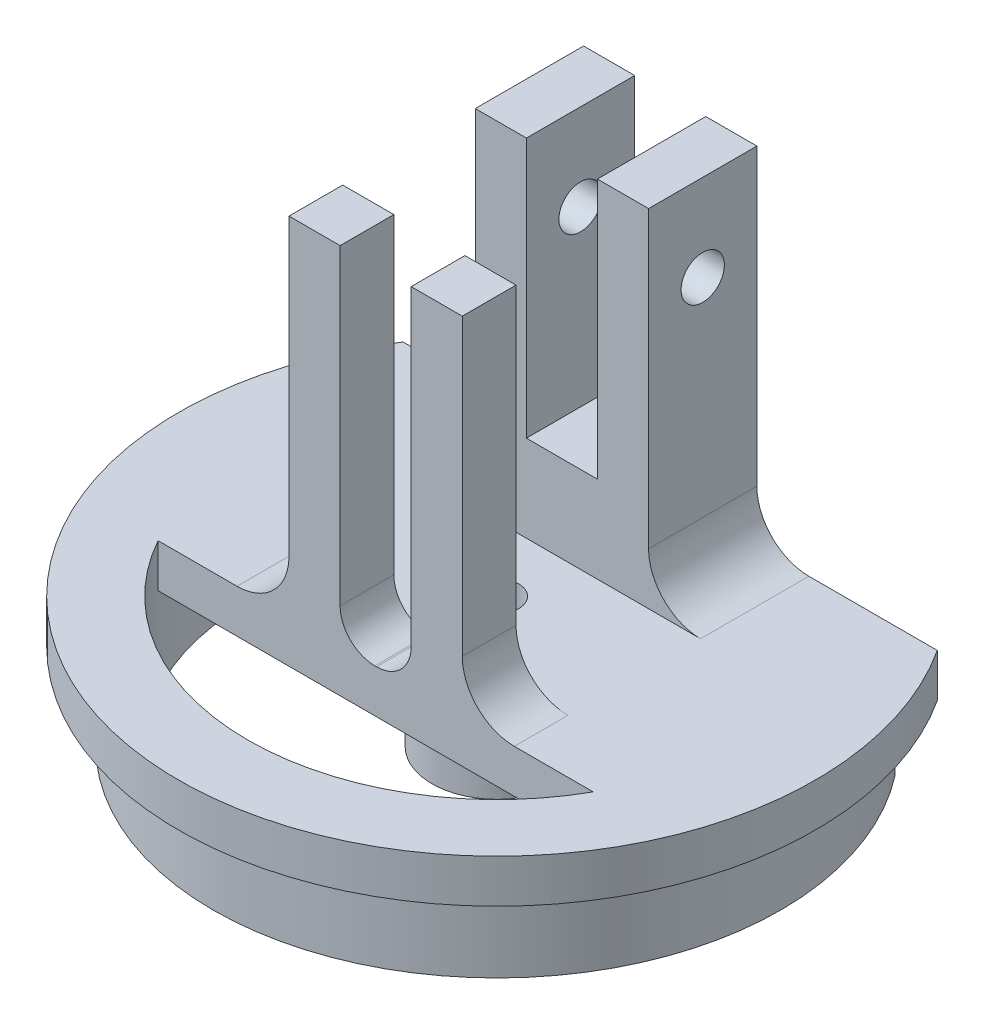
from build123d import *

# Parameters (mm, degrees)
CYLINDER_DEPTH                  = 5
CYLINDER_DEPTH_BACK             = 10
SKETCH_1_R                      = 7.5
SKETCH_1_R_2                    = 2.5
SKETCH_2_R                      = 36.75
SKETCH_2_R_2                    = 2.5
BASE_HORIZONT_DEPTH             = 5
SKETCH_3_R                      = 32.75
SKETCH_3_R_2                    = 28.75
EDGE_2_DEPTH                    = 15
SKETCH_4_W                      = 20
SKETCH_4_H                      = 17.5
RECTANGLE_DEPTH                 = 40
RECTANGLE_DIRECTION_2_REACH     = 56.094
SKETCH_6_W                      = 8.2
SKETCH_6_H                      = 17.5
CUT_EXTRUDE_5_DEPTH             = 30
CUT_EXTRUDE_6_REACH             = 76.573
SKETCH_7_R                      = 2.5
CUT_EXTRUDE_7_REACH             = 70.747
SKETCH_8_W                      = 61.662387238
SKETCH_8_H                      = 16.75
CUT_EXTRUDE_7_DIRECTION_2_REACH = 70.747
CUT_EXTRUDE_START               = -40
SKETCH_9_W                      = 20
SKETCH_9_H                      = 5
CUT_EXTRUDE_8_DEPTH             = 40
PIE_REACH                       = 67.583
SKETCH_11_W                     = 5.9
SKETCH_11_H                     = 6.2
EXTRUDE_9_DEPTH                 = 40
FILLET_4_R                      = 6
FILLET_5_R                      = 4


with BuildPart() as part:
    # Эскиз1 → cylinder (new, two sides: drawn at the far end of the back side and taken through both)
    with BuildSketch(Plane(origin=(0, 0, 0), x_dir=(1, 0, 0), z_dir=(0, 1, 0)).offset(-CYLINDER_DEPTH_BACK)):
        with Locations(Location((0, 0, 0), (0, 0, 270))):
            Circle(SKETCH_1_R)
        with Locations(Location((0, 0, 0), (0, 0, 270))):
            Circle(SKETCH_1_R_2, mode=Mode.SUBTRACT)
    extrude(amount=CYLINDER_DEPTH + CYLINDER_DEPTH_BACK)

    # Эскиз2 → base horizont (add)
    with BuildSketch(Plane(origin=(0, 0, 0), x_dir=(1, 0, 0), z_dir=(0, 1, 0))):
        with Locations(Location((0, 0, 0), (0, 0, 270))):
            Circle(SKETCH_2_R)
        with Locations(Location((0, 0, 0), (0, 0, 270))):
            Circle(SKETCH_2_R_2, mode=Mode.SUBTRACT)
    extrude(amount=BASE_HORIZONT_DEPTH)

    # Эскиз3 → edge 2 (add)
    with BuildSketch(Plane(origin=(0, 5, 0), x_dir=(1, 0, 0), z_dir=(0, 1, 0))):
        with Locations(Location((0, 0, 0), (0, 0, 270))):
            Circle(SKETCH_3_R)
        with Locations(Location((0, 0, 0), (0, 0, 270))):
            Circle(SKETCH_3_R_2, mode=Mode.SUBTRACT)
    extrude(amount=-EDGE_2_DEPTH)

    # Эскиз4 → rectangle (add)
    with BuildSketch(Plane(origin=(0, 5, 0), x_dir=(1, 0, 0), z_dir=(0, 1, 0))):
        with Locations((0, 11.25)):
            Rectangle(SKETCH_4_W, SKETCH_4_H)
    extrude(amount=RECTANGLE_DEPTH)

    # rectangle direction 2: up to this face of the body (flat: up to its plane)
    rectangle_direction_2_end = Plane(part.part.faces().sort_by_distance((0, -10, -31.823690117))[0])
    # Эскиз4 → rectangle direction 2 (add, up to the picked face)
    with BuildSketch(Plane(origin=(0, 5, 0), x_dir=(1, 0, 0), z_dir=(0, 1, 0)), mode=Mode.PRIVATE) as rectangle_direction_2_sk1:
        with Locations((0, 11.25)):
            Rectangle(SKETCH_4_W, SKETCH_4_H)
    rectangle_direction_2_tool1 = split(extrude(rectangle_direction_2_sk1.sketch, amount=-RECTANGLE_DIRECTION_2_REACH, mode=Mode.PRIVATE), bisect_by=rectangle_direction_2_end, keep=Keep.BOTH, mode=Mode.PRIVATE)
    add(rectangle_direction_2_tool1.solids().sort_by(Axis((0, 5, -11.25), (0, -1, 0)))[0])

    # Эскиз6 → Вытянуть5 (cut)
    with BuildSketch(Plane(origin=(0, 45, 0), x_dir=(1, 0, 0), z_dir=(0, 1, 0))):
        with Locations((0, 11.25)):
            Rectangle(SKETCH_6_W, SKETCH_6_H)
    extrude(amount=-CUT_EXTRUDE_5_DEPTH, mode=Mode.SUBTRACT)

    # Вытянуть6: up to this face of the body (flat: up to its plane)
    cut_extrude_6_end = Plane(part.part.faces().sort_by_distance((-10, 25, -11.25))[0])
    # Эскиз7 → Вытянуть6 (cut, up to the picked face)
    with BuildSketch(Plane(origin=(10, 0, 0), x_dir=(0, 0, -1), z_dir=(1, 0, 0)), mode=Mode.PRIVATE) as cut_extrude_6_sk1:
        with Locations((13.75, 35)):
            Circle(SKETCH_7_R)
    cut_extrude_6_tool1 = split(extrude(cut_extrude_6_sk1.sketch, amount=-CUT_EXTRUDE_6_REACH, mode=Mode.PRIVATE), bisect_by=cut_extrude_6_end, keep=Keep.BOTH, mode=Mode.PRIVATE)
    add(cut_extrude_6_tool1.solids().sort_by(Axis((10, 35, -13.75), (-1, 0, 0)))[0], mode=Mode.SUBTRACT)

    # Эскиз8 → Вытянуть7 (cut, up to next)
    with BuildSketch(Plane(origin=(0, 0, 0), x_dir=(1, 0, 0), z_dir=(0, 1, 0)), mode=Mode.PRIVATE) as cut_extrude_7_sk1:
        with Locations((0, 28.375)):
            Rectangle(SKETCH_8_W, SKETCH_8_H)
    cut_extrude_7_tool1 = extrude(cut_extrude_7_sk1.sketch, amount=CUT_EXTRUDE_7_REACH, mode=Mode.PRIVATE) & part.part
    add(cut_extrude_7_tool1.solids().sort_by_distance((0, 0, -28.375))[0], mode=Mode.SUBTRACT)

    # Эскиз8 → Вытянуть7 direction 2 (cut, up to next)
    with BuildSketch(Plane(origin=(0, 0, 0), x_dir=(1, 0, 0), z_dir=(0, 1, 0)), mode=Mode.PRIVATE) as cut_extrude_7_direction_2_sk1:
        with Locations((0, 28.375)):
            Rectangle(SKETCH_8_W, SKETCH_8_H)
    cut_extrude_7_direction_2_tool1 = extrude(cut_extrude_7_direction_2_sk1.sketch, amount=-CUT_EXTRUDE_7_DIRECTION_2_REACH, mode=Mode.PRIVATE) & part.part
    add(cut_extrude_7_direction_2_tool1.solids().sort_by_distance((0, 0, -28.375))[0], mode=Mode.SUBTRACT)

    # Эскиз9 → Вытянуть8 (cut)
    with BuildSketch(Plane(origin=(0, 45, 0), x_dir=(1, 0, 0), z_dir=(0, 1, 0)).offset(CUT_EXTRUDE_START)):
        with Locations((0, 5)):
            Rectangle(SKETCH_9_W, SKETCH_9_H)
    extrude(amount=CUT_EXTRUDE_8_DEPTH, mode=Mode.SUBTRACT)

    # Эскиз10 → pie (cut, up to next)
    with BuildSketch(Plane(origin=(0, 5, 0), x_dir=(1, 0, 0), z_dir=(0, 1, 0)), mode=Mode.PRIVATE) as pie_sk1:
        with BuildLine():
            Line((-25.111003564, -14), (25.111003564, -14))
            ThreePointArc((25.111003564, -14), (0, -28.75), (-25.111003564, -14))
        make_face()
    pie_tool1 = extrude(pie_sk1.sketch, amount=-PIE_REACH, mode=Mode.PRIVATE) & part.part
    add(pie_tool1.solids().sort_by_distance((0, 5, 20.052651))[0], mode=Mode.SUBTRACT)

    # Эскиз11 → Вытянуть9 (add)
    with BuildSketch(Plane(origin=(0, 5, 0), x_dir=(1, 0, 0), z_dir=(0, 1, 0))):
        with Locations((-7.05, -10.9)):
            Rectangle(SKETCH_11_W, SKETCH_11_H)
        with Locations((7.05, -10.9)):
            Rectangle(SKETCH_11_W, SKETCH_11_H)
    extrude(amount=EXTRUDE_9_DEPTH)

    # Скругление4
    fillet_4_edges = [part.edges().sort_by_distance(p)[0] for p in [
        (10, 5, -13.75),
        (-10, 5, 10.9),
        (10, 5, 10.9),
        (-10, 5, -13.75),
    ]]
    fillet(fillet_4_edges, radius=FILLET_4_R)

    # Скругление5
    fillet_5_edges = [part.edges().sort_by_distance(p)[0] for p in [
        (-4.1, 5, 10.9),
        (4.1, 5, 10.9),
    ]]
    fillet(fillet_5_edges, radius=FILLET_5_R)


solid = part.part
